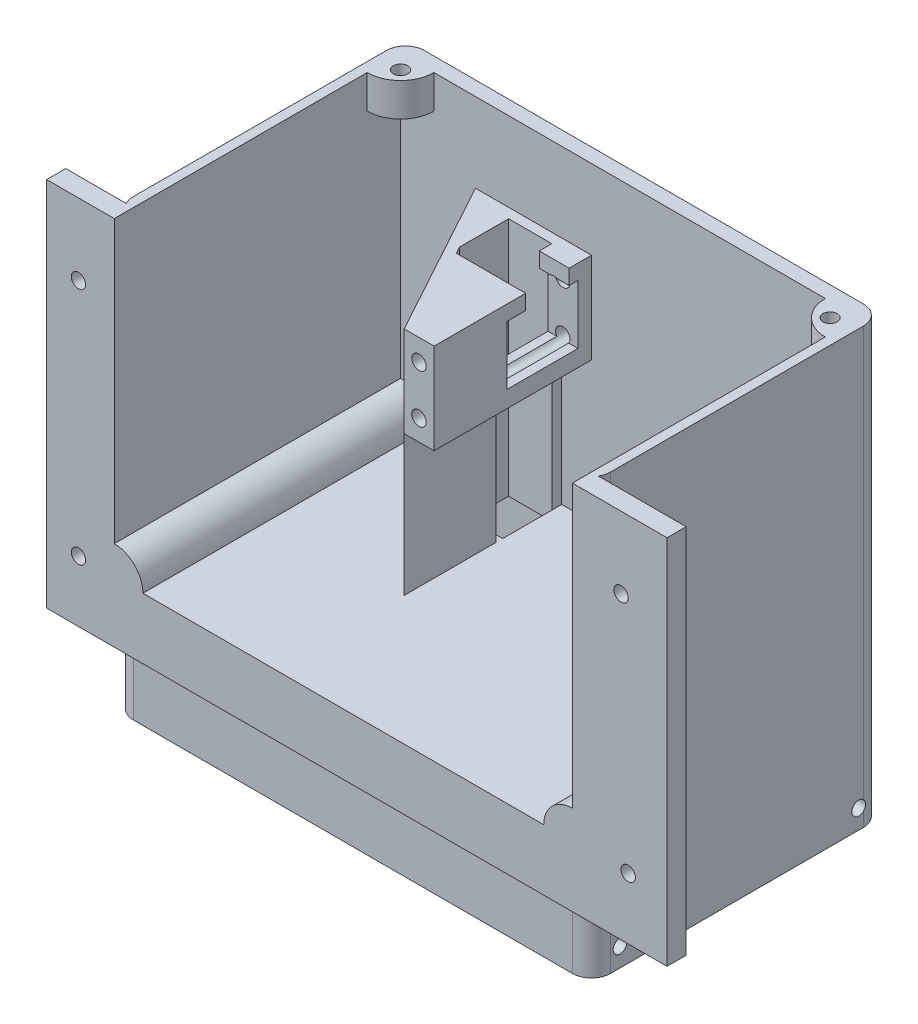
from build123d import *

# Parameters (mm, degrees)
BOSS_EXTRUDE1_DEPTH     = 70
SKETCH2_W               = 100
SKETCH2_H               = 100
BOSS_EXTRUDE2_DEPTH     = 2
SKETCH3_W               = 6.255686465
SKETCH3_H               = 19
SKETCH3_R               = 1.5
SKETCH3_W_2             = 6.249842205
BOSS_EXTRUDE4_DEPTH     = 33
CUT_EXTRUDE2_DEPTH      = 49
CUT_EXTRUDE2_DEPTH_BACK = 10
SKETCH4_W               = 14.879207683
SKETCH4_H               = 12.351519759
SKETCH5_W               = 96.00443459
SKETCH5_H               = 43.693152777
BOSS_EXTRUDE5_DEPTH     = 2
SKETCH9_W               = 100
SKETCH9_H               = 100
CUT_EXTRUDE3_DEPTH      = 42
SKETCH8_R               = 1.5
BOSS_EXTRUDE7_DEPTH     = 40
CUT_EXTRUDE5_DEPTH      = 3
CUT_EXTRUDE8_DEPTH      = 30
BOSS_EXTRUDE13_DEPTH    = 49
SKETCH22_W              = 9.057824242
SKETCH22_H              = 10.302435688
CUT_EXTRUDE9_DEPTH      = 49
SKETCH23_W              = 6.249842205
SKETCH23_H              = 9.108482359
CUT_EXTRUDE10_DEPTH     = 6
SKETCH24_W              = 100
SKETCH24_H              = 60
BOSS_EXTRUDE14_DEPTH    = 24
BOSS_EXTRUDE15_DEPTH    = 10
SKETCH26_W              = 12.16305128
SKETCH26_H              = 77.784654704
SKETCH26_R              = 1.5
SKETCH26_W_2            = 17.83694872
BOSS_EXTRUDE16_DEPTH    = 7
SKETCH27_W              = 100
SKETCH27_H              = 91
BOSS_EXTRUDE17_DEPTH    = 1
SKETCH26_3_W            = 12.16305128
SKETCH26_3_H            = 77.784654704
SKETCH26_3_R            = 1.5
SKETCH26_3_W_2          = 17.83694872
CUT_EXTRUDE11_DEPTH     = 8
BOSS_EXTRUDE18_DEPTH    = 48.362014423
BOSS_EXTRUDE19_REACH    = 109.996
SKETCH32_W              = 9.225924477
SKETCH32_H              = 17.102993801
BOSS_EXTRUDE20_DEPTH    = 60
SKETCH34_W              = 12.16305128
SKETCH34_H              = 77.784654704
SKETCH34_R              = 1.5
SKETCH34_W_2            = 17.83694872
BOSS_EXTRUDE21_DEPTH    = 4
FILLET1_R               = 4
SKETCH38_R              = 1.45
CUT_EXTRUDE32_DEPTH     = 127


with BuildPart() as part:
    # Sketch1 → Boss-Extrude1 (new body)
    with BuildSketch(Plane.XY):
        Polygon((-47.671840355, 33.254988914), (-47.671840355, 35.254988914), (-49.667405765, 35.254988914), (-49.667405765, -64.745011086), (50.332594235, -64.745011086), (50.332594235, 35.254988914), (48.332594235, 35.254988914), (48.332594235, 33.254988914), (48.332594235, -62.745011086), (-47.671840355, -62.745011086), align=None)
    extrude(amount=BOSS_EXTRUDE1_DEPTH)

    # Sketch2 → Boss-Extrude2 (add)
    with BuildSketch(Plane(origin=(0, 0, 0), x_dir=(-1, 0, 0), z_dir=(0, 0, -1))):
        with Locations((-0.332594235, -14.745011086)):
            Rectangle(SKETCH2_W, SKETCH2_H)
    extrude(amount=BOSS_EXTRUDE2_DEPTH)

    # Sketch3 → Boss-Extrude4 (add)
    # profile 1 of 2: a face of its own
    with BuildSketch(Plane.XY):
        with Locations((37.062045054, -23.882996664)):
            Rectangle(SKETCH3_W, SKETCH3_H)
        with Locations((37.169542955, -19.02966579)):
            Circle(SKETCH3_R, mode=Mode.SUBTRACT)
        with Locations((37.189888286, -28.916071788)):
            Circle(SKETCH3_R, mode=Mode.SUBTRACT)
    # profile 2 of 2: a face of its own
    with BuildSketch(Plane.XY):
        with Locations((-10.777585785, -23.882996664)):
            Rectangle(SKETCH3_W_2, SKETCH3_H)
        with Locations((-10.805764952, -18.882996664)):
            Circle(SKETCH3_R, mode=Mode.SUBTRACT)
        with Locations((-10.830457045, -29.02966579)):
            Circle(SKETCH3_R, mode=Mode.SUBTRACT)
    extrude(amount=BOSS_EXTRUDE4_DEPTH)

    # Sketch4 → Cut-Extrude2 (cut, two sides: drawn at the far end of the back side and taken through both)
    with BuildSketch(Plane.ZY.offset(-33.934201821).offset(-CUT_EXTRUDE2_DEPTH_BACK)):
        with Locations((10.28647213, -23.707236785)):
            Rectangle(SKETCH4_W, SKETCH4_H)
    extrude(amount=CUT_EXTRUDE2_DEPTH + CUT_EXTRUDE2_DEPTH_BACK, mode=Mode.SUBTRACT)

    # Sketch5 → Boss-Extrude5 (add)
    with BuildSketch(Plane.XY.offset(70)):
        with Locations((0.33037694, -40.898434698)):
            Rectangle(SKETCH5_W, SKETCH5_H)
    extrude(amount=-BOSS_EXTRUDE5_DEPTH)

    # Sketch9 → Cut-Extrude3 (cut)
    with BuildSketch(Plane(origin=(0, 0, 58), x_dir=(-1, 0, 0), z_dir=(0, 0, -1))):
        with Locations((-0.332594235, -14.745011086)):
            Rectangle(SKETCH9_W, SKETCH9_H)
    extrude(amount=-CUT_EXTRUDE3_DEPTH, mode=Mode.SUBTRACT)

    # Sketch8 → Boss-Extrude7 (add)
    # profile 1 of 2: a face of its own
    with BuildSketch(Plane(origin=(0, 35.254988914, 0), x_dir=(1, 0, 0), z_dir=(0, 1, 0))):
        with BuildLine():
            Line((-47.671840355, 0), (-40.671840355, 0))
            ThreePointArc((-40.671840355, 0), (-42.722092886, -4.949747468), (-47.671840355, -7))
            Line((-47.671840355, -7), (-47.671840355, 0))
        make_face()
        with Locations(Location((-44.671840355, -3, 0), (0, 0, 270))):
            Circle(SKETCH8_R, mode=Mode.SUBTRACT)
    # profile 2 of 2: a face of its own
    with BuildSketch(Plane(origin=(0, 35.254988914, 0), x_dir=(1, 0, 0), z_dir=(0, 1, 0))):
        with BuildLine():
            Line((48.332594235, 0), (48.332594235, -7))
            ThreePointArc((48.332594235, -7), (43.382846767, -4.949747468), (41.332594235, 0))
            Line((41.332594235, 0), (48.332594235, 0))
        make_face()
        with Locations(Location((45.332594235, -3, 0), (0, 0, 270))):
            Circle(SKETCH8_R, mode=Mode.SUBTRACT)
    extrude(amount=-BOSS_EXTRUDE7_DEPTH)

    # Sketch15 → Cut-Extrude5 (cut)
    with BuildSketch(Plane(origin=(0, 35.254988914, 0), x_dir=(1, 0, 0), z_dir=(0, 1, 0))):
        with BuildLine():
            Line((-47.671840355, -58), (-47.671840355, -7))
            ThreePointArc((-47.671840355, -7), (-42.722092886, -4.949747468), (-40.671840355, 0))
            Line((-40.671840355, 0), (41.332594235, 0))
            ThreePointArc((41.332594235, 0), (43.382846767, -4.949747468), (48.332594235, -7))
            Line((48.332594235, -7), (48.332594235, -58))
            Line((48.332594235, -58), (50.332594235, -58))
            Line((50.332594235, -58), (50.332594235, 2))
            Line((50.332594235, 2), (-49.667405765, 2))
            Line((-49.667405765, 2), (-49.667405765, -58))
            Line((-49.667405765, -58), (-47.671840355, -58))
        make_face()
    extrude(amount=-CUT_EXTRUDE5_DEPTH, mode=Mode.SUBTRACT)

    # Sketch17 → Cut-Extrude8 (cut)
    with BuildSketch(Plane(origin=(0, 32.254988914, 0), x_dir=(1, 0, 0), z_dir=(0, 1, 0))):
        with BuildLine():
            Line((-49.667405765, -58), (-47.671840355, -58))
            Line((-47.671840355, -58), (-47.671840355, -7))
            ThreePointArc((-47.671840355, -7), (-42.722092886, -4.949747468), (-40.671840355, 0))
            Line((-40.671840355, 0), (41.332594235, 0))
            ThreePointArc((41.332594235, 0), (43.382846767, -4.949747468), (48.332594235, -7))
            Line((48.332594235, -7), (48.332594235, -58))
            Line((48.332594235, -58), (50.332594235, -58))
            Line((50.332594235, -58), (50.332594235, 2))
            Line((50.332594235, 2), (-49.667405765, 2))
            Line((-49.667405765, 2), (-49.667405765, -58))
        make_face()
    extrude(amount=-CUT_EXTRUDE8_DEPTH, mode=Mode.SUBTRACT)

    # Sketch20 → Boss-Extrude13 (add)
    with BuildSketch(Plane(origin=(0, -14.382996664, 0), x_dir=(1, 0, 0), z_dir=(0, 1, 0))):
        Polygon((-31.974224554, 0), (-13.902506887, -33), (-13.902506887, -21.773589894), (-17.739289379, -21.773589894), (-28.682683987, -2.071271291), (-16.311001374, -2.071271291), (-13.902506887, -2.071271291), (-13.902506887, 0), align=None)
    extrude(amount=-BOSS_EXTRUDE13_DEPTH)

    # Sketch22 → Cut-Extrude9 (cut)
    with BuildSketch(Plane(origin=(0, -62.745011086, 0), x_dir=(1, 0, 0), z_dir=(0, 1, 0))):
        with Locations((-18.431419008, -7.222489135)):
            Rectangle(SKETCH22_W, SKETCH22_H)
    extrude(amount=-CUT_EXTRUDE9_DEPTH, mode=Mode.SUBTRACT)

    # Sketch23 → Cut-Extrude10 (cut)
    with BuildSketch(Plane(origin=(0, -14.382996664, 0), x_dir=(1, 0, 0), z_dir=(0, 1, 0))):
        with Locations((-10.777585785, -9.255735205)):
            Rectangle(SKETCH23_W, SKETCH23_H)
    extrude(amount=-CUT_EXTRUDE10_DEPTH, mode=Mode.SUBTRACT)

    # Sketch24 → Boss-Extrude14 (add)
    with BuildSketch(Plane.XZ.offset(64.745011086)):
        with Locations((0.332594235, 28)):
            Rectangle(SKETCH24_W, SKETCH24_H)
        Polygon((-42.167405765, 55.5), (42.832594235, 55.5), (42.832594235, 50.5), (47.832594235, 50.5), (47.832594235, 5.5), (41.89954029, 5.5), (41.89954029, 0.5), (-42.167405765, 0.5), (-42.167405765, 5.5), (-47.167405765, 5.5), (-47.167405765, 50.5), (-42.167405765, 50.5), align=None, mode=Mode.SUBTRACT)
    extrude(amount=BOSS_EXTRUDE14_DEPTH)

    # Sketch25 → Boss-Extrude15 (add)
    with BuildSketch(Plane.XY.offset(58)):
        Polygon((-49.667405765, -75.52966579), (50.332594235, -75.52966579), (50.332594235, 2.254988914), (48.332594235, 2.254988914), (48.332594235, -62.745011086), (-47.671840355, -62.745011086), (-47.671840355, 2.254988914), (-49.667405765, 2.254988914), align=None)
    extrude(amount=BOSS_EXTRUDE15_DEPTH)

    # Sketch26 → Boss-Extrude16 (add)
    # profile 1 of 2: a face of its own
    with BuildSketch(Plane.XY.offset(68)):
        with Locations((-55.748931405, -36.637338438)):
            Rectangle(SKETCH26_W, SKETCH26_H)
        with Locations((-55.064132406, -60.52966579)):
            Circle(SKETCH26_R, mode=Mode.SUBTRACT)
        with Locations((-55.064132406, -10.52966579)):
            Circle(SKETCH26_R, mode=Mode.SUBTRACT)
    # profile 2 of 2: a face of its own
    with BuildSketch(Plane.XY.offset(68)):
        with Locations((59.251068595, -36.637338438)):
            Rectangle(SKETCH26_W_2, SKETCH26_H)
        with Locations((58.061257032, -60.52966579)):
            Circle(SKETCH26_R, mode=Mode.SUBTRACT)
        with Locations((58.061257032, -10.52966579)):
            Circle(SKETCH26_R, mode=Mode.SUBTRACT)
    extrude(amount=-BOSS_EXTRUDE16_DEPTH)

    # Sketch27 → Boss-Extrude17 (add)
    with BuildSketch(Plane(origin=(0, 0, -2), x_dir=(-1, 0, 0), z_dir=(0, 0, -1))):
        with Locations((-0.332594235, -43.245011086)):
            Rectangle(SKETCH27_W, SKETCH27_H)
    extrude(amount=BOSS_EXTRUDE17_DEPTH)

    # Sketch26<3> → Cut-Extrude11 (cut)
    # profile 1 of 3: a face of its own
    with BuildSketch(Plane.XY.offset(68)):
        with Locations((-55.748931405, -36.637338438)):
            Rectangle(SKETCH26_3_W, SKETCH26_3_H)
        with Locations((-55.064132406, -60.52966579)):
            Circle(SKETCH26_3_R, mode=Mode.SUBTRACT)
        with Locations((-55.064132406, -10.52966579)):
            Circle(SKETCH26_3_R, mode=Mode.SUBTRACT)
    # profile 2 of 3: a face of its own
    with BuildSketch(Plane.XY.offset(68)):
        with Locations((59.251068595, -36.637338438)):
            Rectangle(SKETCH26_3_W_2, SKETCH26_3_H)
        with Locations((58.061257032, -60.52966579)):
            Circle(SKETCH26_3_R, mode=Mode.SUBTRACT)
        with Locations((58.061257032, -10.52966579)):
            Circle(SKETCH26_3_R, mode=Mode.SUBTRACT)
    # profile 3 of 3: a face of its own
    with BuildSketch(Plane.XY.offset(68)):
        Polygon((50.332594235, -75.52966579), (50.332594235, 2.254988914), (48.332594235, 2.254988914), (48.332594235, -62.745011086), (-47.671840355, -62.745011086), (-47.671840355, 2.254988914), (-49.667405765, 2.254988914), (-49.667405765, -75.52966579), align=None)
    extrude(amount=-CUT_EXTRUDE11_DEPTH, mode=Mode.SUBTRACT)

    # Sketch28 → Boss-Extrude18 (add)
    with BuildSketch(Plane(origin=(0, -62.745011086, 0), x_dir=(1, 0, 0), z_dir=(0, 1, 0))):
        Polygon((-28.682683987, -2.071271291), (-22.960331129, -12.373706979), (-22.960331129, -2.071271291), align=None)
        Polygon((-13.902506887, -21.773589894), (-13.902506887, -13.809976384), (-22.162574115, -13.809976384), (-17.739289379, -21.773589894), align=None)
    extrude(amount=BOSS_EXTRUDE18_DEPTH)

    # Boss-Extrude19: up to this face of the body (flat: up to its plane)
    boss_extrude19_end = Plane(part.part.faces().sort_by_distance((1.391538042, -62.745011086, 30.9964467))[0])
    # Sketch32 → Boss-Extrude19 (add, up to the picked face)
    with BuildSketch(Plane(origin=(0, -14.382996664, 0), x_dir=(1, 0, 0), z_dir=(0, 1, 0)), mode=Mode.PRIVATE) as boss_extrude19_sk1:
        with Locations((43.719631996, -24.4485031)):
            Rectangle(SKETCH32_W, SKETCH32_H)
    boss_extrude19_tool1 = split(extrude(boss_extrude19_sk1.sketch, amount=-BOSS_EXTRUDE19_REACH, mode=Mode.PRIVATE), bisect_by=boss_extrude19_end, keep=Keep.BOTH, mode=Mode.PRIVATE)
    add(boss_extrude19_tool1.solids().sort_by(Axis((43.719632, -14.382997, 24.448503), (0, -1, 0)))[0])

    # Sketch33 → Boss-Extrude20 (add)
    with BuildSketch(Plane.XY):
        with BuildLine():
            Line((-47.671840355, -62.745011086), (-41.671840355, -62.745011086))
            ThreePointArc((-41.671840355, -62.745011086), (-43.429199668, -58.502370399), (-47.671840355, -56.745011086))
            Line((-47.671840355, -56.745011086), (-47.671840355, -62.745011086))
        make_face()
        with BuildLine():
            Line((48.332594235, -62.745011086), (42.332594235, -62.745011086))
            ThreePointArc((42.332594235, -62.745011086), (44.089953548, -58.502370399), (48.332594235, -56.745011086))
            Line((48.332594235, -56.745011086), (48.332594235, -62.745011086))
        make_face()
    extrude(amount=BOSS_EXTRUDE20_DEPTH)

    # Sketch34 → Boss-Extrude21 (add)
    # profile 1 of 2: a face of its own
    with BuildSketch(Plane.XY.offset(60)):
        with Locations((-55.748931405, -36.637338438)):
            Rectangle(SKETCH34_W, SKETCH34_H)
        with Locations((-55.176188723, -62.745011086)):
            Circle(SKETCH34_R, mode=Mode.SUBTRACT)
        with Locations((-55.176188723, -12.745011086)):
            Circle(SKETCH34_R, mode=Mode.SUBTRACT)
    # profile 2 of 2: a face of its own
    with BuildSketch(Plane.XY.offset(60)):
        with Locations((59.251068595, -36.637338438)):
            Rectangle(SKETCH34_W_2, SKETCH34_H)
        with Locations((60.035918121, -62.745011086)):
            Circle(SKETCH34_R, mode=Mode.SUBTRACT)
        with Locations((58.535918121, -12.745011086)):
            Circle(SKETCH34_R, mode=Mode.SUBTRACT)
    extrude(amount=-BOSS_EXTRUDE21_DEPTH)

    # Fillet1
    fillet1_edges = [part.edges().sort_by_distance(p)[0] for p in [
        (-49.667405765, -82.137338438, 58),
        (50.332594235, -82.137338438, 58),
        (50.332594235, -43.245011086, -3),
        (-49.667405765, -43.245011086, -3),
    ]]
    fillet(fillet1_edges, radius=FILLET1_R)

    # Sketch38 → Cut-Extrude32 (cut)
    with BuildSketch(Plane.ZY.offset(49.667405765)):
        with Locations(Location((2, -84.745011086, 0), (0, 0, 226.397181027))):
            Circle(SKETCH38_R)
        with Locations(Location((52, -84.745011086, 0), (0, 0, 270))):
            Circle(SKETCH38_R)
    extrude(amount=-CUT_EXTRUDE32_DEPTH, mode=Mode.SUBTRACT)


solid = part.part
